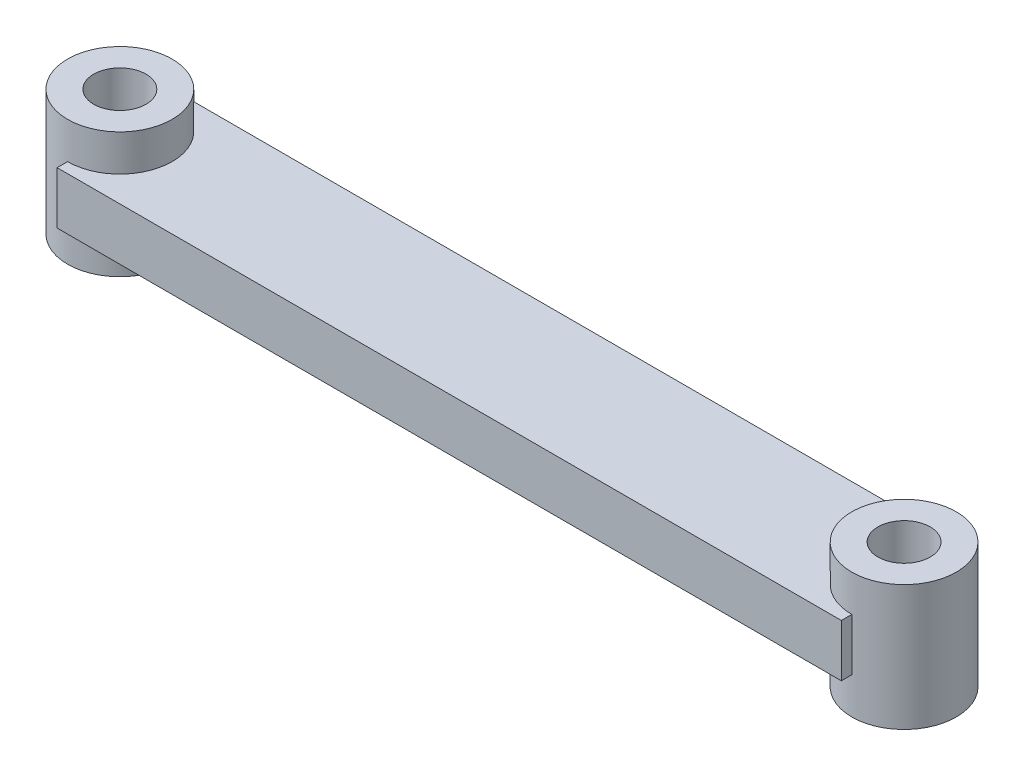
from build123d import *

# Parameters (mm, degrees)
SKETCH1_W                = 48
SKETCH1_H                = 20
BOSS_EXTRUDE1_DEPTH      = 300
BOSS_EXTRUDE2_DEPTH      = 24
BOSS_EXTRUDE2_DEPTH_BACK = 24
SKETCH2_R                = 20
BOSS_EXTRUDE3_DEPTH      = 24
BOSS_EXTRUDE3_DEPTH_BACK = 24
SKETCH3_R                = 20
CUT_EXTRUDE1_DEPTH       = 50
CUT_EXTRUDE1_DEPTH_BACK  = 50
SKETCH4_R                = 10
CUT_EXTRUDE2_DEPTH       = 50
CUT_EXTRUDE2_DEPTH_BACK  = 50
SKETCH5_R                = 10


with BuildPart() as part:
    # Sketch1 → Boss-Extrude1 (new body)
    with BuildSketch(Plane(origin=(0, 0, 0), x_dir=(0, 0, -1), z_dir=(1, 0, 0))):
        Rectangle(SKETCH1_W, SKETCH1_H)
    extrude(amount=BOSS_EXTRUDE1_DEPTH)

    # Sketch2 → Boss-Extrude2 (add, two sides: drawn at the far end of the back side and taken through both)
    with BuildSketch(Plane(origin=(0, 0, 0), x_dir=(1, 0, 0), z_dir=(0, 1, 0)).offset(-BOSS_EXTRUDE2_DEPTH_BACK)):
        Circle(SKETCH2_R)
    extrude(amount=BOSS_EXTRUDE2_DEPTH + BOSS_EXTRUDE2_DEPTH_BACK)

    # Sketch3 → Boss-Extrude3 (add, two sides: drawn at the far end of the back side and taken through both)
    with BuildSketch(Plane(origin=(0, 0, 0), x_dir=(1, 0, 0), z_dir=(0, 1, 0)).offset(-BOSS_EXTRUDE3_DEPTH_BACK)):
        with Locations((300, 0)):
            Circle(SKETCH3_R)
    extrude(amount=BOSS_EXTRUDE3_DEPTH + BOSS_EXTRUDE3_DEPTH_BACK)

    # Sketch4 → Cut-Extrude1 (cut, two sides: drawn at the far end of the back side and taken through both)
    with BuildSketch(Plane(origin=(0, 0, 0), x_dir=(1, 0, 0), z_dir=(0, 1, 0)).offset(-CUT_EXTRUDE1_DEPTH_BACK)):
        Circle(SKETCH4_R)
    extrude(amount=CUT_EXTRUDE1_DEPTH + CUT_EXTRUDE1_DEPTH_BACK, mode=Mode.SUBTRACT)

    # Sketch5 → Cut-Extrude2 (cut, two sides: drawn at the far end of the back side and taken through both)
    with BuildSketch(Plane(origin=(0, 0, 0), x_dir=(1, 0, 0), z_dir=(0, 1, 0)).offset(-CUT_EXTRUDE2_DEPTH_BACK)):
        with Locations((300, 0)):
            Circle(SKETCH5_R)
    extrude(amount=CUT_EXTRUDE2_DEPTH + CUT_EXTRUDE2_DEPTH_BACK, mode=Mode.SUBTRACT)


solid = part.part
